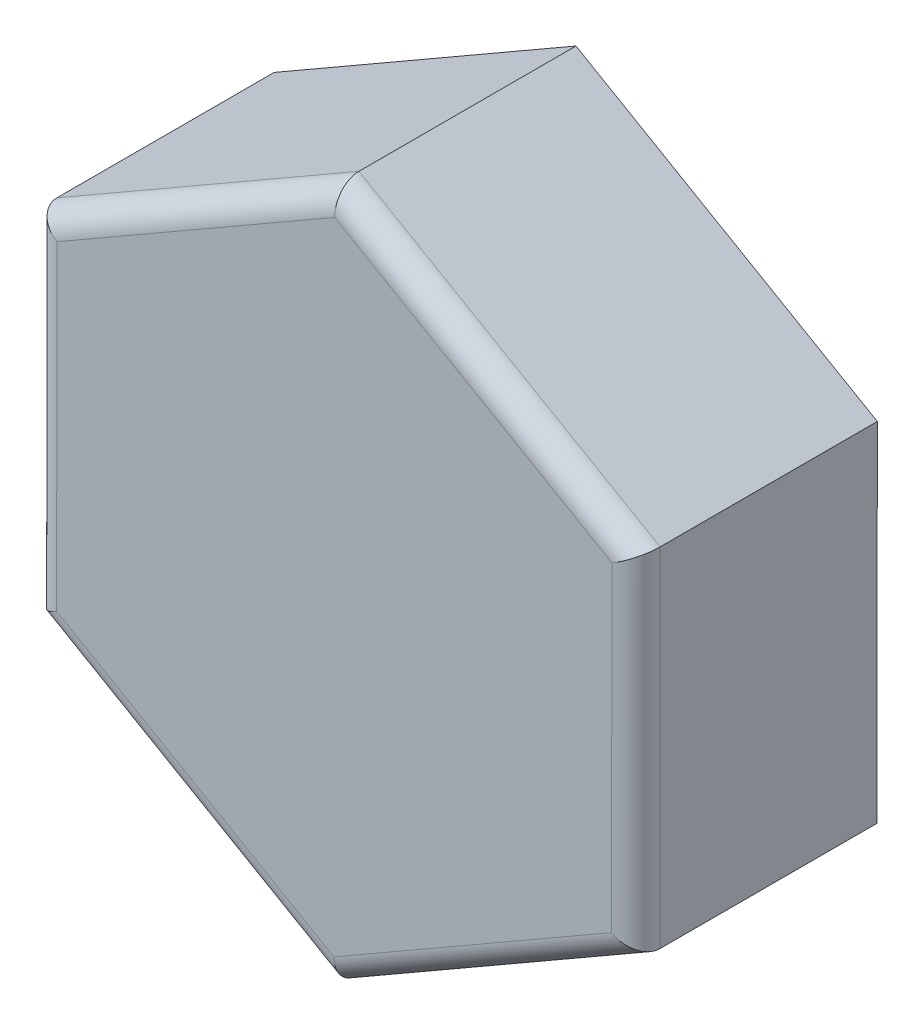
from build123d import *

# Parameters (mm, degrees)
BOSS_EXTRUDE1_DEPTH = 1
FILLET1_R           = 0.1
SKETCH2_R           = 0.8
CUT_EXTRUDE1_DEPTH  = 0.01


with BuildPart() as part:
    # Sketch1 → Boss-Extrude1 (new body)
    with BuildSketch(Plane.XY):
        Polygon((-1.92119998, -0.610240597), (-1.919472265, 0.833134042), (-3.168607513, 1.556317607), (-4.419470474, 0.836126532), (-4.421198189, -0.607248107), (-3.172062942, -1.330431671), align=None)
    extrude(amount=BOSS_EXTRUDE1_DEPTH)

    # Fillet1
    fillet1_edges = [part.edges().sort_by_distance(p)[0] for p in [
        (-2.544039889, 1.194725824, 1),
        (-3.794038993, 1.196222069, 1),
        (-4.420334332, 0.114439212, 1),
        (-3.796630565, -0.968839889, 1),
        (-2.546631461, -0.970336134, 1),
        (-1.920336123, 0.111446723, 1),
    ]]
    fillet(fillet1_edges, radius=FILLET1_R)

    # Sketch2 → Cut-Extrude1 (cut)
    with BuildSketch(Plane(origin=(0, 0, 0), x_dir=(-1, 0, 0), z_dir=(0, 0, -1))):
        with Locations((3.170335227, 0.112942968)):
            Circle(SKETCH2_R)
    extrude(amount=-CUT_EXTRUDE1_DEPTH, mode=Mode.SUBTRACT)


solid = part.part
